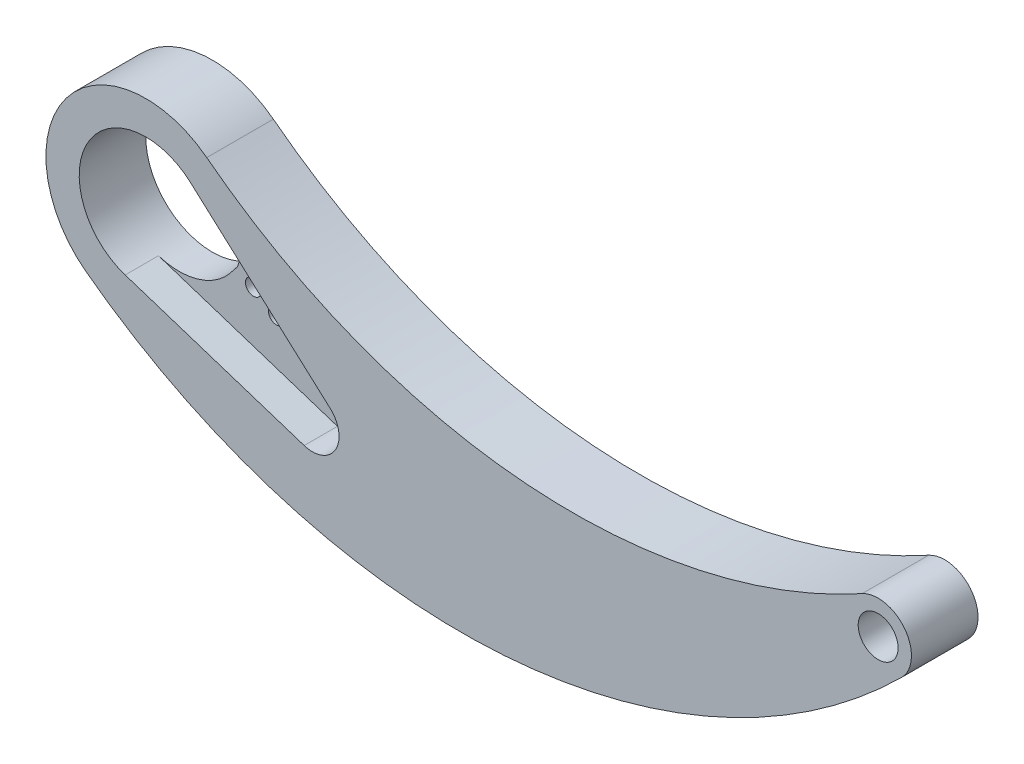
from build123d import *

# Parameters (mm, degrees)
SKETCH1_R           = 7.5
SKETCH1_R_2         = 5
SKETCH1_R_3         = 2.5
SKETCH1_R_4         = 1.5
BOSS_EXTRUDE1_DEPTH = 5
SKETCH2_R           = 0.6
CUT_EXTRUDE1_DEPTH  = 10
CUT_EXTRUDE2_START  = -2.5
CUT_EXTRUDE2_DEPTH  = 2.5


with BuildPart() as part:
    # Sketch1 → Boss-Extrude1 (new body)
    # profile 1 of 3: a face of its own
    with BuildSketch(Plane.XY):
        with BuildLine():
            ThreePointArc((53.791866029, 2.188701055), (28.624593116, -3.284466085), (4.577922078, 5.940760006))
            ThreePointArc((4.577922078, 5.940760006), (6.729948573, 3.310255611), (7.5, 0))
            ThreePointArc((7.5, 0), (3.356031274, -6.707238932), (-4.496547756, -6.002587632))
            ThreePointArc((-4.496547756, -6.002587632), (26.917032253, -15.274892681), (56.759448417, -1.776046528))
            ThreePointArc((56.759448417, -1.776046528), (52.998552336, -1.498067838), (53.791866029, 2.188701055))
        make_face()
    # profile 2 of 3: a face of its own
    with BuildSketch(Plane.XY):
        Circle(SKETCH1_R)
        Circle(SKETCH1_R_2, mode=Mode.SUBTRACT)
    # profile 3 of 3: a face of its own
    with BuildSketch(Plane.XY):
        with Locations((55, 0)):
            Circle(SKETCH1_R_3)
        with Locations((55, 0)):
            Circle(SKETCH1_R_4, mode=Mode.SUBTRACT)
    extrude(amount=BOSS_EXTRUDE1_DEPTH)

    # Sketch2 → Cut-Extrude1 (cut)
    with BuildSketch(Plane.XY.offset(5)):
        with Locations((3.853813047, -2.225)):
            Circle(SKETCH2_R)
        with Locations((5.585863854, -3.225)):
            Circle(SKETCH2_R)
        with Locations((7.317914662, -4.225)):
            Circle(SKETCH2_R)
        with Locations((9.04996547, -5.225)):
            Circle(SKETCH2_R)
        with Locations((10.782016277, -6.225)):
            Circle(SKETCH2_R)
        with Locations((12.514067085, -7.225)):
            Circle(SKETCH2_R)
    extrude(amount=-CUT_EXTRUDE1_DEPTH, mode=Mode.SUBTRACT)

    # Sketch3 → Cut-Extrude2 (cut)
    with BuildSketch(Plane.XY.offset(5).offset(CUT_EXTRUDE2_START)):
        with BuildLine():
            Line((13.851873565, -5.738301032), (3.344516201, 3.71674742))
            ThreePointArc((3.344516201, 3.71674742), (4.330127019, -2.5), (-1.546539584, -4.754809703))
            Line((-1.546539584, -4.754809703), (11.895451251, -9.126923881))
            ThreePointArc((11.895451251, -9.126923881), (14.246117892, -8.225), (13.851873565, -5.738301032))
        make_face()
    extrude(amount=CUT_EXTRUDE2_DEPTH, mode=Mode.SUBTRACT)


solid = part.part
